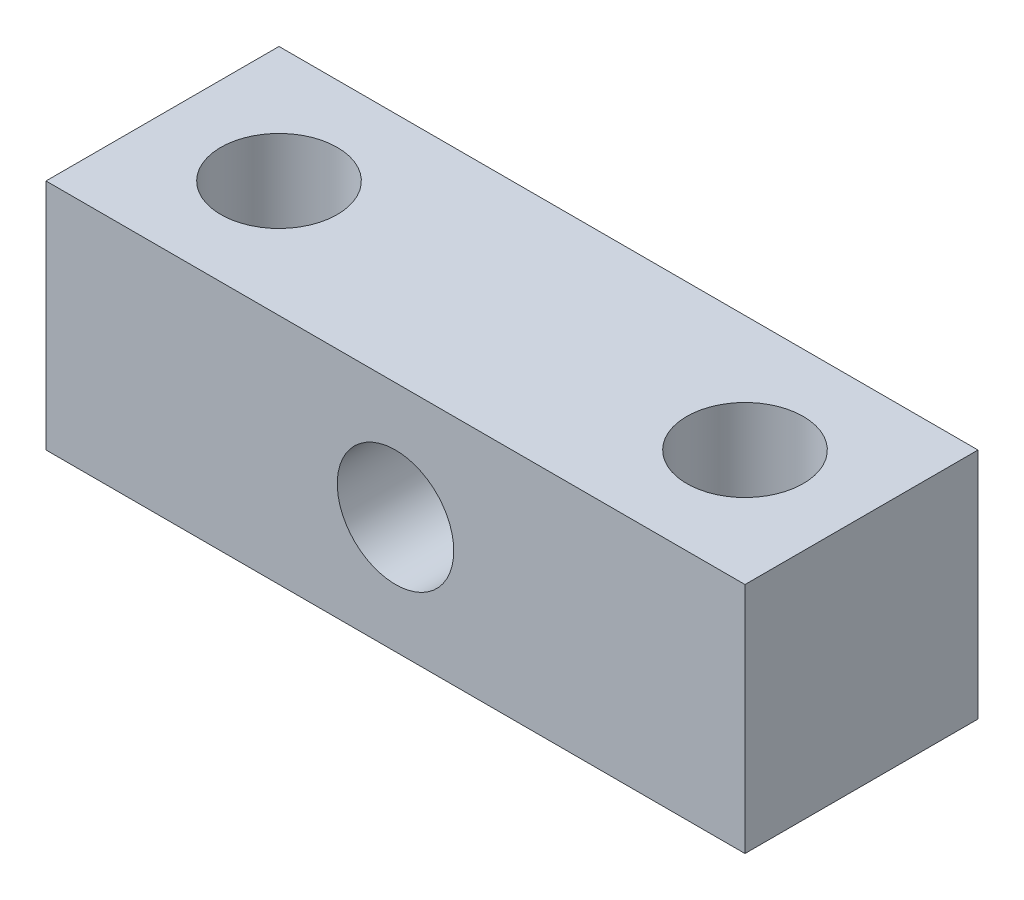
from build123d import *

# Parameters (mm, degrees)
SKETCH_1_W          = 12
SKETCH_1_H          = 4
EXTRUDE_1_DEPTH     = 4
SKETCH_2_R          = 1
CUT_EXTRUDE_1_DEPTH = 11
SKETCH_3_R          = 1
CUT_EXTRUDE_2_DEPTH = 11


with BuildPart() as part:
    # 草圖1 → 填料-伸長1 (new body)
    with BuildSketch(Plane.XY):
        with Locations((-0.194141854, 1.08496732)):
            Rectangle(SKETCH_1_W, SKETCH_1_H)
    extrude(amount=EXTRUDE_1_DEPTH)

    # 草圖2 → 除料-伸長1 (cut)
    with BuildSketch(Plane.XZ.offset(0.91503268)):
        with Locations(Location((-4.194141854, 2, 0), (0, 0, 270))):
            Circle(SKETCH_2_R)
        with Locations(Location((3.805858146, 2, 0), (0, 0, 270))):
            Circle(SKETCH_2_R)
    extrude(amount=-CUT_EXTRUDE_1_DEPTH, mode=Mode.SUBTRACT)

    # 草圖3 → 除料-伸長2 (cut)
    with BuildSketch(Plane.XY.offset(4)):
        with Locations((-0.194141854, 1.08496732)):
            Circle(SKETCH_3_R)
    extrude(amount=-CUT_EXTRUDE_2_DEPTH, mode=Mode.SUBTRACT)


solid = part.part
